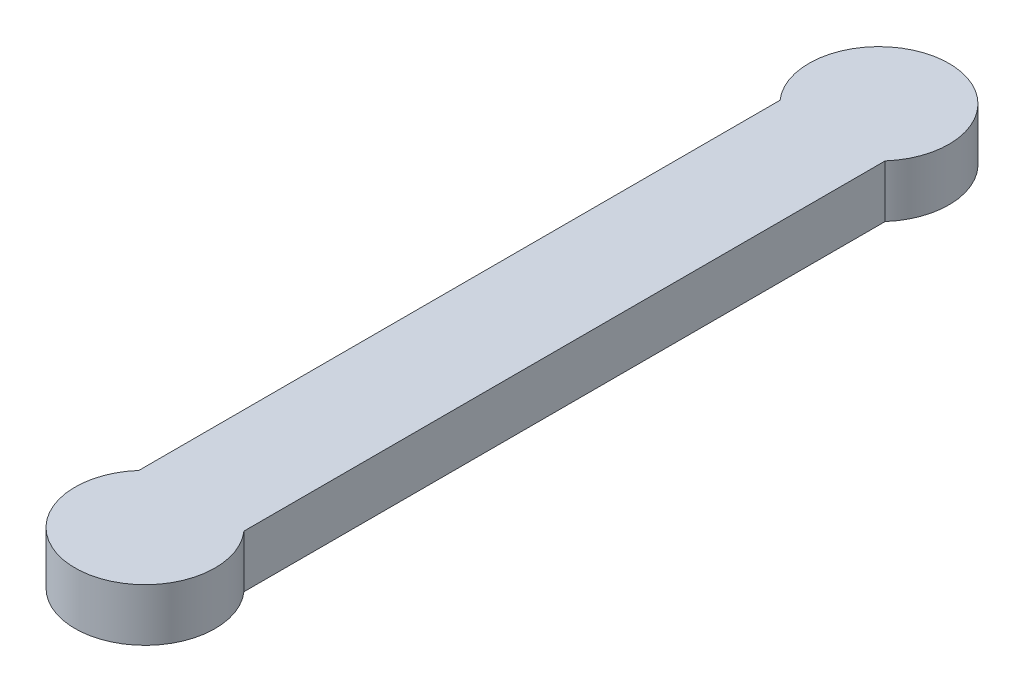
from build123d import *

# Parameters (mm, degrees)
BOSS_EXTRUDE1_DEPTH = 3


with BuildPart() as part:
    # Sketch1 → Boss-Extrude1 (new body)
    with BuildSketch(Plane(origin=(0, 0, 0), x_dir=(1, 0, 0), z_dir=(0, 1, 0))):
        with BuildLine():
            Line((-3, 39.254248689), (-3, 2.645751311))
            ThreePointArc((-3, 2.645751311), (0, -4), (3, 2.645751311))
            Line((3, 2.645751311), (3, 39.254248689))
            ThreePointArc((3, 39.254248689), (0, 45.9), (-3, 39.254248689))
        make_face()
    extrude(amount=BOSS_EXTRUDE1_DEPTH)


solid = part.part
